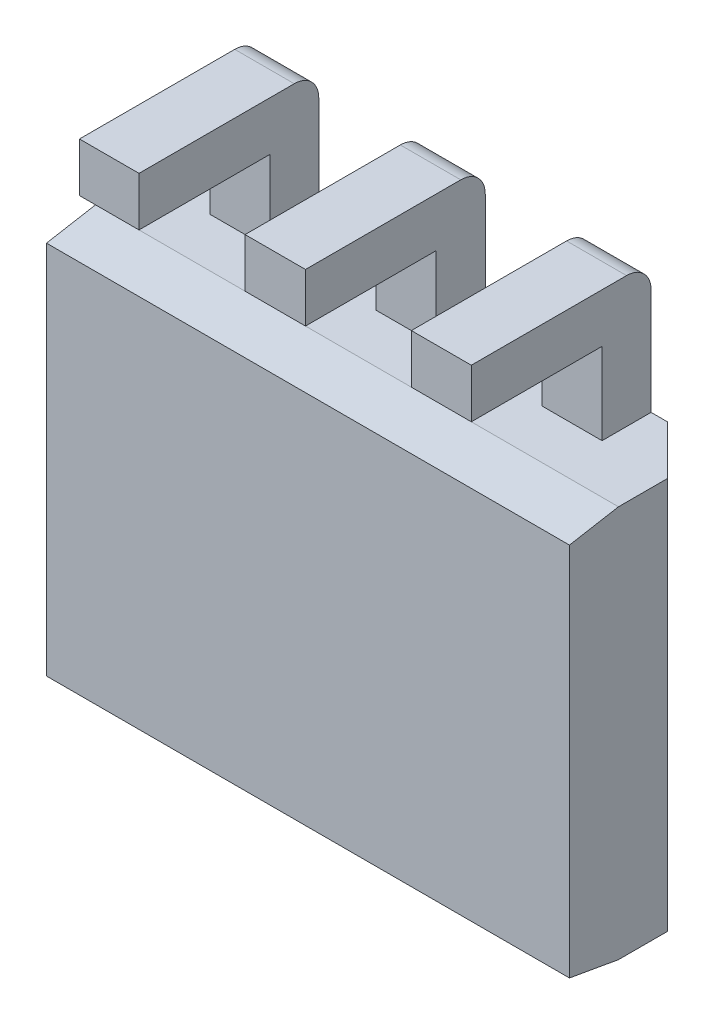
from build123d import *

# Parameters (mm, degrees)
CROQUIS1_W              = 4
CROQUIS1_H              = 3
SALIENTE_EXTRUIR1_DEPTH = 1.5
CORTAR_EXTRUIR1_DEPTH   = 3
CORTAR_EXTRUIR2_DEPTH   = 4
CROQUIS7_W              = 0.455301138
CROQUIS7_H              = 0.375
CROQUIS7_W_2            = 0.462078838
CROQUIS7_W_3            = 0.458790222
SALIENTE_EXTRUIR3_DEPTH = 1
CROQUIS8_W              = 0.462078838
CROQUIS8_H              = 0.375
CROQUIS8_W_2            = 0.458790222
CROQUIS8_W_3            = 0.455301138
SALIENTE_EXTRUIR4_DEPTH = 1
CORTAR_EXTRUIR3_DEPTH   = 3


with BuildPart() as part:
    # Croquis1 → Saliente-Extruir1 (new body)
    with BuildSketch(Plane.XY):
        Rectangle(CROQUIS1_W, CROQUIS1_H)
    extrude(amount=SALIENTE_EXTRUIR1_DEPTH)

    # Croquis3 → Cortar-Extruir1 (cut)
    with BuildSketch(Plane(origin=(0, 1.5, 0), x_dir=(1, 0, 0), z_dir=(0, 1, 0))):
        Polygon((-2, 0), (-2, -0.75), (-1.25, 0), align=None)
        Polygon((1.25, 0), (2, -0.75), (2, 0), align=None)
    extrude(amount=-CORTAR_EXTRUIR1_DEPTH, mode=Mode.SUBTRACT)

    # Croquis6 → Cortar-Extruir2 (cut)
    with BuildSketch(Plane(origin=(2, 0, 0), x_dir=(0, 0, -1), z_dir=(1, 0, 0))):
        Polygon((0, 1.125), (0, 1.5), (-0.375, 1.5), align=None)
        Polygon((0, -1.5), (0, -1.433877382), (-0.375, -1.5), align=None)
        Polygon((-1.5, 1.433877382), (-1.125, 1.5), (-1.5, 1.5), align=None)
        Polygon((-1.5, -1.5), (-1.125, -1.5), (-1.5, -1.433877382), align=None)
    extrude(amount=-CORTAR_EXTRUIR2_DEPTH, mode=Mode.SUBTRACT)

    # Croquis7 → Saliente-Extruir3 (add)
    with BuildSketch(Plane(origin=(0, 1.5, 0), x_dir=(1, 0, 0), z_dir=(0, 1, 0))):
        with Locations((-1.27, -0.5625)):
            Rectangle(CROQUIS7_W, CROQUIS7_H)
        with Locations((0, -0.5625)):
            Rectangle(CROQUIS7_W_2, CROQUIS7_H)
        with Locations((1.27, -0.5625)):
            Rectangle(CROQUIS7_W_3, CROQUIS7_H)
    extrude(amount=SALIENTE_EXTRUIR3_DEPTH)

    # Croquis8 → Saliente-Extruir4 (add)
    with BuildSketch(Plane.XY.offset(0.75)):
        with Locations((0, 2.3125)):
            Rectangle(CROQUIS8_W, CROQUIS8_H)
        with Locations((1.27, 2.3125)):
            Rectangle(CROQUIS8_W_2, CROQUIS8_H)
        with Locations((-1.27, 2.3125)):
            Rectangle(CROQUIS8_W_3, CROQUIS8_H)
    extrude(amount=SALIENTE_EXTRUIR4_DEPTH)

    # Croquis11 → Cortar-Extruir3 (cut)
    with BuildSketch(Plane(origin=(1.499395111, 0, 0), x_dir=(0, 0, -1), z_dir=(1, 0, 0))):
        with BuildLine():
            Line((-0.375, 2.3125), (-0.375, 2.5))
            Line((-0.375, 2.5), (-0.5625, 2.5))
            ThreePointArc((-0.5625, 2.5), (-0.429917479, 2.445082521), (-0.375, 2.3125))
        make_face()
    extrude(amount=-CORTAR_EXTRUIR3_DEPTH, mode=Mode.SUBTRACT)


solid = part.part
